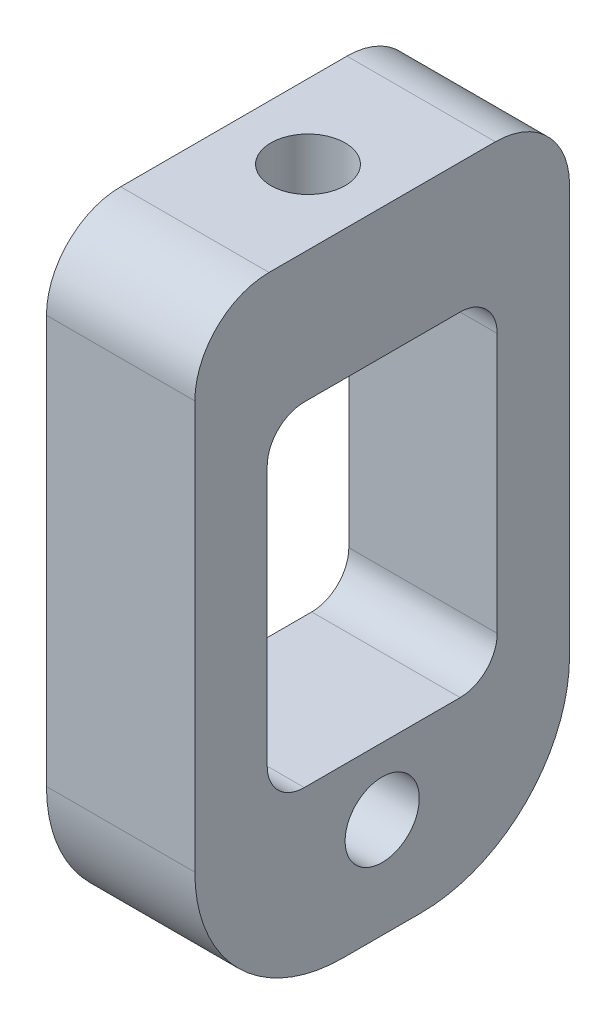
from build123d import *

# Parameters (mm, degrees)
SKETCH21_W          = 4
SKETCH21_H          = 10.1
BOSS_EXTRUDE1_DEPTH = 17
SKETCH22_R          = 1
CUT_EXTRUDE4_DEPTH  = 4
SKETCH23_W          = 6.2
SKETCH23_H          = 9
CUT_EXTRUDE5_DEPTH  = 4
SKETCH24_R          = 1
CUT_EXTRUDE6_DEPTH  = 3.5
FILLET4_R           = 4
FILLET5_R           = 2
FILLET6_R           = 1


with BuildPart() as part:
    # Sketch21 → Boss-Extrude1 (new body)
    with BuildSketch(Plane(origin=(0, 0, 0), x_dir=(1, 0, 0), z_dir=(0, 1, 0))):
        Rectangle(SKETCH21_W, SKETCH21_H)
    extrude(amount=BOSS_EXTRUDE1_DEPTH)

    # Sketch22 → Cut-Extrude4 (cut)
    with BuildSketch(Plane.ZY.offset(2)):
        with Locations((0, 2.7)):
            Circle(SKETCH22_R)
    extrude(amount=-CUT_EXTRUDE4_DEPTH, mode=Mode.SUBTRACT)

    # Sketch23 → Cut-Extrude5 (cut)
    with BuildSketch(Plane.ZY.offset(2)):
        with Locations((0, 9)):
            Rectangle(SKETCH23_W, SKETCH23_H)
    extrude(amount=-CUT_EXTRUDE5_DEPTH, mode=Mode.SUBTRACT)

    # Sketch24 → Cut-Extrude6 (cut)
    with BuildSketch(Plane(origin=(0, 17, 0), x_dir=(1, 0, 0), z_dir=(0, 1, 0))):
        with Locations(Location((0, 0, 0), (0, 0, 270))):
            Circle(SKETCH24_R)
    extrude(amount=-CUT_EXTRUDE6_DEPTH, mode=Mode.SUBTRACT)

    # Fillet4
    fillet4_edges = [part.edges().sort_by_distance(p)[0] for p in [
        (0, 0, 5.05),
        (0, 0, -5.05),
    ]]
    fillet(fillet4_edges, radius=FILLET4_R)

    # Fillet5
    fillet5_edges = [part.edges().sort_by_distance(p)[0] for p in [
        (0, 17, 5.05),
        (0, 17, -5.05),
    ]]
    fillet(fillet5_edges, radius=FILLET5_R)

    # Fillet6
    fillet6_edges = [part.edges().sort_by_distance(p)[0] for p in [
        (0, 13.5, 3.1),
        (0, 4.5, 3.1),
        (0, 4.5, -3.1),
        (0, 13.5, -3.1),
    ]]
    fillet(fillet6_edges, radius=FILLET6_R)


solid = part.part
